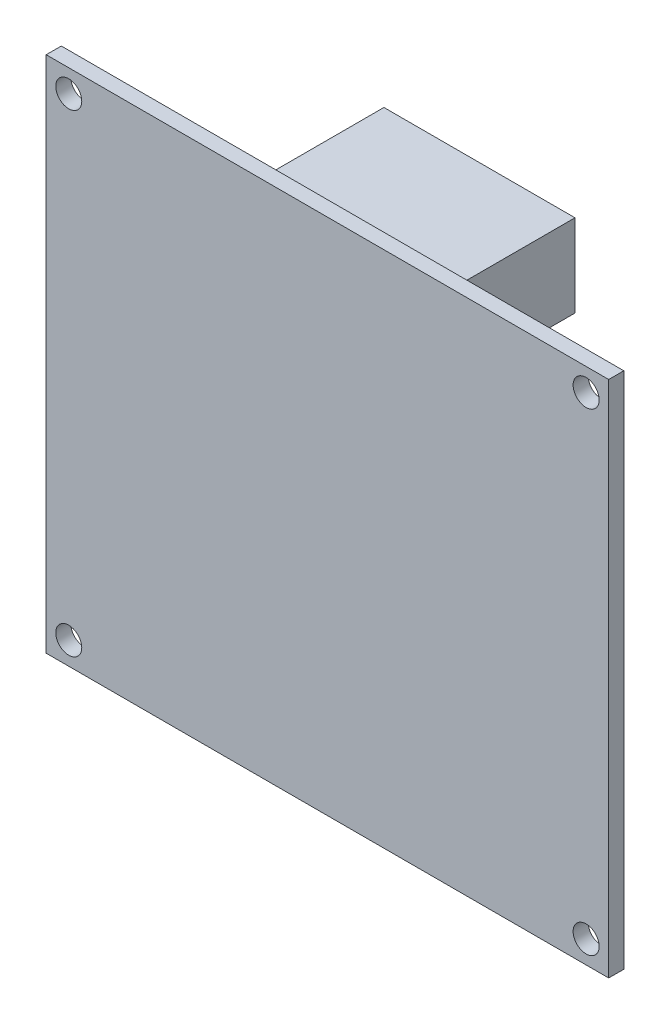
from build123d import *

# Parameters (mm, degrees)
SKETCH1_W           = 61.468
SKETCH1_H           = 56.642
BOSS_EXTRUDE1_DEPTH = 0.8255
SKETCH6_W           = 20.8788
SKETCH6_H           = 9.017
BOSS_EXTRUDE3_DEPTH = 13.081
SKETCH3_R           = 1.4224
CUT_EXTRUDE1_DEPTH  = 45.313537672


with BuildPart() as part:
    # Sketch1 → Boss-Extrude1 (new, symmetric)
    with BuildSketch(Plane.XY):
        Rectangle(SKETCH1_W, SKETCH1_H)
    extrude(amount=BOSS_EXTRUDE1_DEPTH, both=True)

    # Sketch6 → Boss-Extrude3 (add)
    with BuildSketch(Plane(origin=(0, 0, -0.8255), x_dir=(-1, 0, 0), z_dir=(0, 0, -1))):
        with Locations((-1.8796, 22.5425)):
            Rectangle(SKETCH6_W, SKETCH6_H)
    extrude(amount=BOSS_EXTRUDE3_DEPTH)

    # Sketch3 → Cut-Extrude1 (cut, through all)
    with BuildSketch(Plane.XY.offset(0.8255)):
        with Locations((-28.2702, 25.8572)):
            Circle(SKETCH3_R)
        with Locations((28.2702, 25.8572)):
            Circle(SKETCH3_R)
        with Locations((28.2702, -25.8572)):
            Circle(SKETCH3_R)
        with Locations((-28.2702, -25.8572)):
            Circle(SKETCH3_R)
    extrude(amount=-CUT_EXTRUDE1_DEPTH, mode=Mode.SUBTRACT)


solid = part.part
